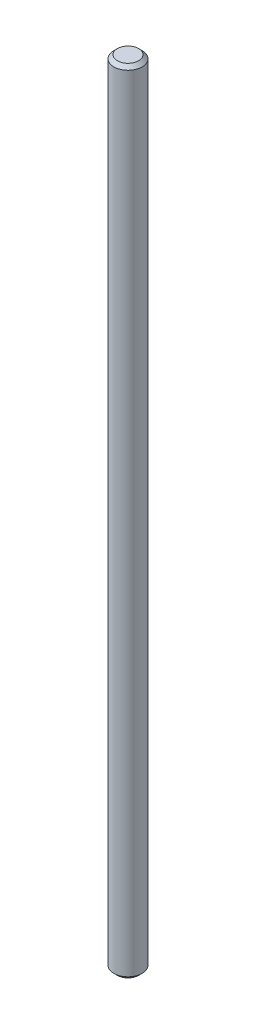
from build123d import *

# Parameters (mm, degrees)
SKETCH1_R           = 4
BOSS_EXTRUDE1_DEPTH = 224
CHAMFER1_SIZE       = 1


with BuildPart() as part:
    # Sketch1 → Boss-Extrude1 (new body)
    with BuildSketch(Plane(origin=(0, 224, 0), x_dir=(1, 0, 0), z_dir=(0, 1, 0))):
        with Locations(Location((0, 0, 0), (0, 0, 90))):
            Circle(SKETCH1_R)
    extrude(amount=-BOSS_EXTRUDE1_DEPTH)

    # Chamfer1
    chamfer1_edges = [part.edges().sort_by_distance(p)[0] for p in [
        (0, 224, 4),
        (0, 0, 4),
    ]]
    chamfer(chamfer1_edges, length=CHAMFER1_SIZE)


solid = part.part
